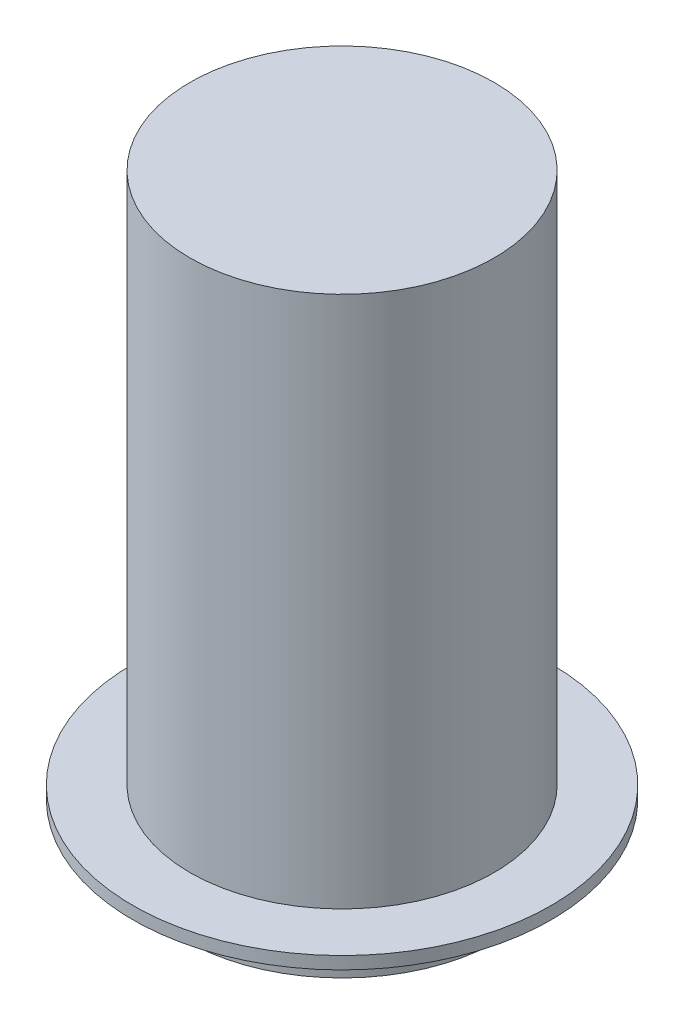
from build123d import *


with BuildPart() as part:
    # Sketch1 → Revolve1 (revolve)
    with BuildSketch(Plane.XY, mode=Mode.PRIVATE) as revolve1_sk:
        Polygon((0, 35.82), (10, 35.82), (10, 0.82), (13.75, 0.82), (13.75, 0), (10.325, 0), (10.325, -2.88), (2, -2.88), (2, -6.9948), (0, -6.9948), align=None)
    revolve(revolve1_sk.sketch.rotate(Axis((0, 0, 0), (0, 1, 0)), 90), axis=Axis((0, 0, 0), (0, 1, 0)))


solid = part.part
